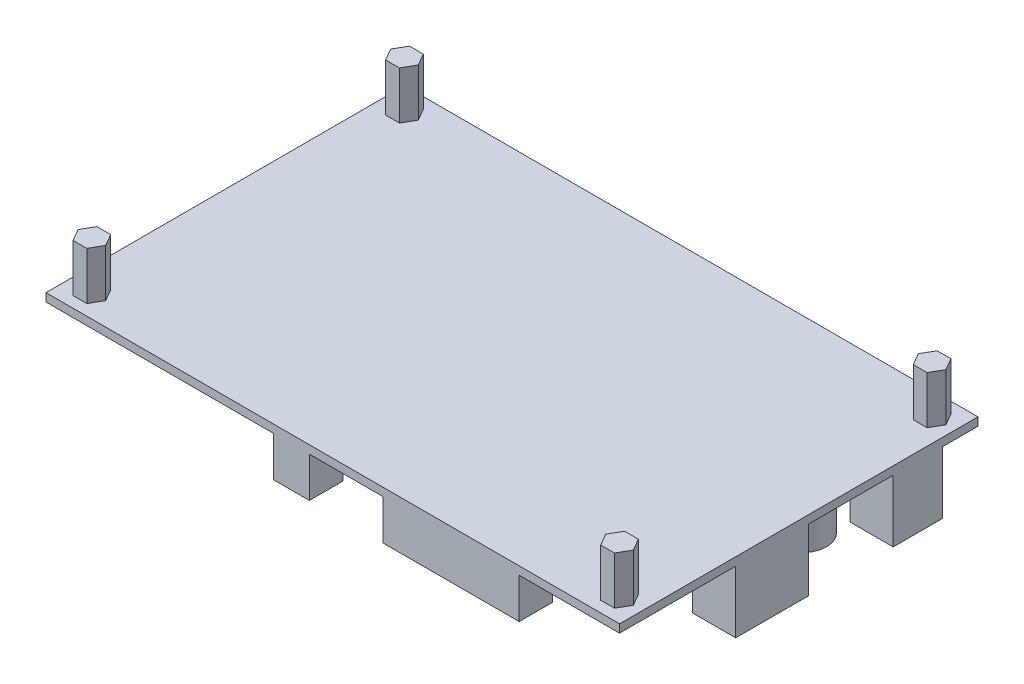
from build123d import *

# Parameters (mm, degrees)
SKETCH_1_W                        = 120
SKETCH_1_H                        = 75
EXTRUDE_1_DEPTH                   = 1.7
EXTRUDE_2_DEPTH                   = 10
SKETCH_3_W                        = 3.75
SKETCH_3_H                        = 7
EXTRUDE_3_DEPTH                   = 8.4
SKETCH_4_W                        = 28.5
SKETCH_4_H                        = 7
EXTRUDE_4_DEPTH                   = 8.4
SKETCH_5_W                        = 9
SKETCH_5_H                        = 15.2
EXTRUDE_5_DEPTH                   = 13
SKETCH_6_W                        = 9
SKETCH_6_H                        = 10.3
EXTRUDE_6_DEPTH                   = 13
SKETCH_7_R                        = 5.1
EXTRUDE_7_DEPTH                   = 16.3
SKETCH_8_W                        = 3
SKETCH_8_H                        = 2
EXTRUDE_8_DEPTH                   = 3
SKETCH_9_W                        = 1
SKETCH_9_H                        = 1
EXTRUDE_9_DEPTH                   = 8
PATTERN_LINEAR_2_COUNT            = 13
PATTERN_LINEAR_2_PITCH            = 4.183333333
PATTERN_LINEAR_3_COUNT            = 2
PATTERN_LINEAR_3_PITCH            = 2.5
PATTERN_LINEAR_3_COPY_1_SKETCH_W  = 3
PATTERN_LINEAR_3_COPY_1_SKETCH_H  = 2
PATTERN_LINEAR_3_COPY_1_DEPTH     = 3
PATTERN_LINEAR_3_COPY_2_SKETCH_W  = 3
PATTERN_LINEAR_3_COPY_2_SKETCH_H  = 2
PATTERN_LINEAR_3_COPY_2_DEPTH     = 3
PATTERN_LINEAR_3_COPY_3_SKETCH_W  = 3
PATTERN_LINEAR_3_COPY_3_SKETCH_H  = 2
PATTERN_LINEAR_3_COPY_3_DEPTH     = 3
PATTERN_LINEAR_3_COPY_4_SKETCH_W  = 3
PATTERN_LINEAR_3_COPY_4_SKETCH_H  = 2
PATTERN_LINEAR_3_COPY_4_DEPTH     = 3
PATTERN_LINEAR_3_COPY_5_SKETCH_W  = 3
PATTERN_LINEAR_3_COPY_5_SKETCH_H  = 2
PATTERN_LINEAR_3_COPY_5_DEPTH     = 3
PATTERN_LINEAR_3_COPY_6_SKETCH_W  = 3
PATTERN_LINEAR_3_COPY_6_SKETCH_H  = 2
PATTERN_LINEAR_3_COPY_6_DEPTH     = 3
PATTERN_LINEAR_3_COPY_7_SKETCH_W  = 3
PATTERN_LINEAR_3_COPY_7_SKETCH_H  = 2
PATTERN_LINEAR_3_COPY_7_DEPTH     = 3
PATTERN_LINEAR_3_COPY_8_SKETCH_W  = 3
PATTERN_LINEAR_3_COPY_8_SKETCH_H  = 2
PATTERN_LINEAR_3_COPY_8_DEPTH     = 3
PATTERN_LINEAR_3_COPY_9_SKETCH_W  = 3
PATTERN_LINEAR_3_COPY_9_SKETCH_H  = 2
PATTERN_LINEAR_3_COPY_9_DEPTH     = 3
PATTERN_LINEAR_3_COPY_10_SKETCH_W = 3
PATTERN_LINEAR_3_COPY_10_SKETCH_H = 2
PATTERN_LINEAR_3_COPY_10_DEPTH    = 3
PATTERN_LINEAR_3_COPY_11_SKETCH_W = 3
PATTERN_LINEAR_3_COPY_11_SKETCH_H = 2
PATTERN_LINEAR_3_COPY_11_DEPTH    = 3
PATTERN_LINEAR_3_COPY_12_SKETCH_W = 3
PATTERN_LINEAR_3_COPY_12_SKETCH_H = 2
PATTERN_LINEAR_3_COPY_12_DEPTH    = 3
PATTERN_LINEAR_3_COPY_13_SKETCH_W = 1
PATTERN_LINEAR_3_COPY_13_SKETCH_H = 1
PATTERN_LINEAR_3_COPY_13_DEPTH    = 8
PATTERN_LINEAR_3_COPY_14_SKETCH_W = 1
PATTERN_LINEAR_3_COPY_14_SKETCH_H = 1
PATTERN_LINEAR_3_COPY_14_DEPTH    = 8
PATTERN_LINEAR_3_COPY_15_SKETCH_W = 1
PATTERN_LINEAR_3_COPY_15_SKETCH_H = 1
PATTERN_LINEAR_3_COPY_15_DEPTH    = 8
PATTERN_LINEAR_3_COPY_16_SKETCH_W = 1
PATTERN_LINEAR_3_COPY_16_SKETCH_H = 1
PATTERN_LINEAR_3_COPY_16_DEPTH    = 8
PATTERN_LINEAR_3_COPY_17_SKETCH_W = 1
PATTERN_LINEAR_3_COPY_17_SKETCH_H = 1
PATTERN_LINEAR_3_COPY_17_DEPTH    = 8
PATTERN_LINEAR_3_COPY_18_SKETCH_W = 1
PATTERN_LINEAR_3_COPY_18_SKETCH_H = 1
PATTERN_LINEAR_3_COPY_18_DEPTH    = 8
PATTERN_LINEAR_3_COPY_19_SKETCH_W = 1
PATTERN_LINEAR_3_COPY_19_SKETCH_H = 1
PATTERN_LINEAR_3_COPY_19_DEPTH    = 8
PATTERN_LINEAR_3_COPY_20_SKETCH_W = 1
PATTERN_LINEAR_3_COPY_20_SKETCH_H = 1
PATTERN_LINEAR_3_COPY_20_DEPTH    = 8
PATTERN_LINEAR_3_COPY_21_SKETCH_W = 1
PATTERN_LINEAR_3_COPY_21_SKETCH_H = 1
PATTERN_LINEAR_3_COPY_21_DEPTH    = 8
PATTERN_LINEAR_3_COPY_22_SKETCH_W = 1
PATTERN_LINEAR_3_COPY_22_SKETCH_H = 1
PATTERN_LINEAR_3_COPY_22_DEPTH    = 8
PATTERN_LINEAR_3_COPY_23_SKETCH_W = 1
PATTERN_LINEAR_3_COPY_23_SKETCH_H = 1
PATTERN_LINEAR_3_COPY_23_DEPTH    = 8
PATTERN_LINEAR_3_COPY_24_SKETCH_W = 1
PATTERN_LINEAR_3_COPY_24_SKETCH_H = 1
PATTERN_LINEAR_3_COPY_24_DEPTH    = 8


with BuildPart() as part:
    # Эскиз1 → Бобышка-Вытянуть1 (new body)
    with BuildSketch(Plane(origin=(0, 0, 0), x_dir=(1, 0, 0), z_dir=(0, 1, 0))):
        Rectangle(SKETCH_1_W, SKETCH_1_H)
    extrude(amount=EXTRUDE_1_DEPTH)

    # Эскиз2 → Бобышка-Вытянуть2 (add)
    with BuildSketch(Plane(origin=(0, 1.7, 0), x_dir=(1, 0, 0), z_dir=(0, 1, 0))):
        Polygon((-53.756624327, -30.2), (-56.643375673, -30.2), (-58.086751346, -32.7), (-56.643375673, -35.2), (-53.756624327, -35.2), (-52.313248654, -32.7), align=None)
        Polygon((56.643375673, -35.2), (53.756624327, -35.2), (52.313248654, -32.7), (53.756624327, -30.2), (56.643375673, -30.2), (58.086751346, -32.7), align=None)
        Polygon((52.313248654, 32.7), (53.756624327, 30.2), (56.643375673, 30.2), (58.086751346, 32.7), (56.643375673, 35.2), (53.756624327, 35.2), align=None)
        Polygon((-58.086751346, 32.7), (-56.643375673, 35.2), (-53.756624327, 35.2), (-52.313248654, 32.7), (-53.756624327, 30.2), (-56.643375673, 30.2), align=None)
    extrude(amount=EXTRUDE_2_DEPTH)

    # Эскиз3 → Бобышка-Вытянуть3 (add)
    with BuildSketch(Plane.XZ):
        with Locations((-6.775, 34)):
            Rectangle(SKETCH_3_W, SKETCH_3_H)
    extrude_3 = extrude(amount=EXTRUDE_3_DEPTH)

    # Зеркальное отражение2: Бобышка-Вытянуть3 across plane
    add(extrude_3.mirror(Plane(origin=(-8.65, -8.4, 37.5), x_dir=(0, 0, 1), z_dir=(1, 0, 0))))

    # Эскиз4 → Бобышка-Вытянуть4 (add)
    with BuildSketch(Plane.XZ):
        with Locations((24.75, 34)):
            Rectangle(SKETCH_4_W, SKETCH_4_H)
    extrude(amount=EXTRUDE_4_DEPTH)

    # Эскиз5 → Бобышка-Вытянуть5 (add)
    with BuildSketch(Plane.XZ):
        with Locations((55.5, 5.6)):
            Rectangle(SKETCH_5_W, SKETCH_5_H)
    extrude(amount=EXTRUDE_5_DEPTH)

    # Эскиз6 → Бобышка-Вытянуть6 (add)
    with BuildSketch(Plane.XZ):
        with Locations((55.5, -24.9)):
            Rectangle(SKETCH_6_W, SKETCH_6_H)
    extrude(amount=EXTRUDE_6_DEPTH)

    # Эскиз7 → Бобышка-Вытянуть7 (add)
    with BuildSketch(Plane.XZ):
        with Locations(Location((44.6, -16.1, 0), (0, 0, 90))):
            Circle(SKETCH_7_R)
    extrude(amount=EXTRUDE_7_DEPTH)

    # Эскиз8 → Бобышка-Вытянуть8 (add)
    with BuildSketch(Plane.XZ):
        with Locations((10.2, -7.9)):
            Rectangle(SKETCH_8_W, SKETCH_8_H)
    extrude_8 = extrude(amount=EXTRUDE_8_DEPTH)

    # Эскиз9 → Бобышка-Вытянуть9 (add)
    with BuildSketch(Plane.XZ.offset(3)):
        with Locations((10.335563445, -7.88710339)):
            Rectangle(SKETCH_9_W, SKETCH_9_H)
    extrude_9 = extrude(amount=EXTRUDE_9_DEPTH)

    # Линейный массив2: Бобышка-Вытянуть8, Бобышка-Вытянуть9 ×13
    with Locations(*[(-i * PATTERN_LINEAR_2_PITCH, 0, 0) for i in range(1, PATTERN_LINEAR_2_COUNT)]):
        add(extrude_8)
        add(extrude_9)

    # Линейный массив3: Бобышка-Вытянуть8, Бобышка-Вытянуть9 ×2
    with Locations(*[(0, 0, -i * PATTERN_LINEAR_3_PITCH) for i in range(1, PATTERN_LINEAR_3_COUNT)]):
        add(extrude_8)
        add(extrude_9)

    # Линейный массив3 copy 1 sketch → Линейный массив3 copy 1 (add)
    with BuildSketch(Plane(origin=(-4.183333333, 0, -2.5), x_dir=(1, 0, 0), z_dir=(0, -1, 0))):
        with Locations((10.2, -7.9)):
            Rectangle(PATTERN_LINEAR_3_COPY_1_SKETCH_W, PATTERN_LINEAR_3_COPY_1_SKETCH_H)
    extrude(amount=PATTERN_LINEAR_3_COPY_1_DEPTH)

    # Линейный массив3 copy 2 sketch → Линейный массив3 copy 2 (add)
    with BuildSketch(Plane(origin=(-8.366666667, 0, -2.5), x_dir=(1, 0, 0), z_dir=(0, -1, 0))):
        with Locations((10.2, -7.9)):
            Rectangle(PATTERN_LINEAR_3_COPY_2_SKETCH_W, PATTERN_LINEAR_3_COPY_2_SKETCH_H)
    extrude(amount=PATTERN_LINEAR_3_COPY_2_DEPTH)

    # Линейный массив3 copy 3 sketch → Линейный массив3 copy 3 (add)
    with BuildSketch(Plane(origin=(-12.55, 0, -2.5), x_dir=(1, 0, 0), z_dir=(0, -1, 0))):
        with Locations((10.2, -7.9)):
            Rectangle(PATTERN_LINEAR_3_COPY_3_SKETCH_W, PATTERN_LINEAR_3_COPY_3_SKETCH_H)
    extrude(amount=PATTERN_LINEAR_3_COPY_3_DEPTH)

    # Линейный массив3 copy 4 sketch → Линейный массив3 copy 4 (add)
    with BuildSketch(Plane(origin=(-16.733333333, 0, -2.5), x_dir=(1, 0, 0), z_dir=(0, -1, 0))):
        with Locations((10.2, -7.9)):
            Rectangle(PATTERN_LINEAR_3_COPY_4_SKETCH_W, PATTERN_LINEAR_3_COPY_4_SKETCH_H)
    extrude(amount=PATTERN_LINEAR_3_COPY_4_DEPTH)

    # Линейный массив3 copy 5 sketch → Линейный массив3 copy 5 (add)
    with BuildSketch(Plane(origin=(-20.916666667, 0, -2.5), x_dir=(1, 0, 0), z_dir=(0, -1, 0))):
        with Locations((10.2, -7.9)):
            Rectangle(PATTERN_LINEAR_3_COPY_5_SKETCH_W, PATTERN_LINEAR_3_COPY_5_SKETCH_H)
    extrude(amount=PATTERN_LINEAR_3_COPY_5_DEPTH)

    # Линейный массив3 copy 6 sketch → Линейный массив3 copy 6 (add)
    with BuildSketch(Plane(origin=(-25.1, 0, -2.5), x_dir=(1, 0, 0), z_dir=(0, -1, 0))):
        with Locations((10.2, -7.9)):
            Rectangle(PATTERN_LINEAR_3_COPY_6_SKETCH_W, PATTERN_LINEAR_3_COPY_6_SKETCH_H)
    extrude(amount=PATTERN_LINEAR_3_COPY_6_DEPTH)

    # Линейный массив3 copy 7 sketch → Линейный массив3 copy 7 (add)
    with BuildSketch(Plane(origin=(-29.283333333, 0, -2.5), x_dir=(1, 0, 0), z_dir=(0, -1, 0))):
        with Locations((10.2, -7.9)):
            Rectangle(PATTERN_LINEAR_3_COPY_7_SKETCH_W, PATTERN_LINEAR_3_COPY_7_SKETCH_H)
    extrude(amount=PATTERN_LINEAR_3_COPY_7_DEPTH)

    # Линейный массив3 copy 8 sketch → Линейный массив3 copy 8 (add)
    with BuildSketch(Plane(origin=(-33.466666667, 0, -2.5), x_dir=(1, 0, 0), z_dir=(0, -1, 0))):
        with Locations((10.2, -7.9)):
            Rectangle(PATTERN_LINEAR_3_COPY_8_SKETCH_W, PATTERN_LINEAR_3_COPY_8_SKETCH_H)
    extrude(amount=PATTERN_LINEAR_3_COPY_8_DEPTH)

    # Линейный массив3 copy 9 sketch → Линейный массив3 copy 9 (add)
    with BuildSketch(Plane(origin=(-37.65, 0, -2.5), x_dir=(1, 0, 0), z_dir=(0, -1, 0))):
        with Locations((10.2, -7.9)):
            Rectangle(PATTERN_LINEAR_3_COPY_9_SKETCH_W, PATTERN_LINEAR_3_COPY_9_SKETCH_H)
    extrude(amount=PATTERN_LINEAR_3_COPY_9_DEPTH)

    # Линейный массив3 copy 10 sketch → Линейный массив3 copy 10 (add)
    with BuildSketch(Plane(origin=(-41.833333333, 0, -2.5), x_dir=(1, 0, 0), z_dir=(0, -1, 0))):
        with Locations((10.2, -7.9)):
            Rectangle(PATTERN_LINEAR_3_COPY_10_SKETCH_W, PATTERN_LINEAR_3_COPY_10_SKETCH_H)
    extrude(amount=PATTERN_LINEAR_3_COPY_10_DEPTH)

    # Линейный массив3 copy 11 sketch → Линейный массив3 copy 11 (add)
    with BuildSketch(Plane(origin=(-46.016666667, 0, -2.5), x_dir=(1, 0, 0), z_dir=(0, -1, 0))):
        with Locations((10.2, -7.9)):
            Rectangle(PATTERN_LINEAR_3_COPY_11_SKETCH_W, PATTERN_LINEAR_3_COPY_11_SKETCH_H)
    extrude(amount=PATTERN_LINEAR_3_COPY_11_DEPTH)

    # Линейный массив3 copy 12 sketch → Линейный массив3 copy 12 (add)
    with BuildSketch(Plane(origin=(-50.2, 0, -2.5), x_dir=(1, 0, 0), z_dir=(0, -1, 0))):
        with Locations((10.2, -7.9)):
            Rectangle(PATTERN_LINEAR_3_COPY_12_SKETCH_W, PATTERN_LINEAR_3_COPY_12_SKETCH_H)
    extrude(amount=PATTERN_LINEAR_3_COPY_12_DEPTH)

    # Линейный массив3 copy 13 sketch → Линейный массив3 copy 13 (add)
    with BuildSketch(Plane(origin=(-4.183333333, -3, -2.5), x_dir=(1, 0, 0), z_dir=(0, -1, 0))):
        with Locations((10.335563445, -7.88710339)):
            Rectangle(PATTERN_LINEAR_3_COPY_13_SKETCH_W, PATTERN_LINEAR_3_COPY_13_SKETCH_H)
    extrude(amount=PATTERN_LINEAR_3_COPY_13_DEPTH)

    # Линейный массив3 copy 14 sketch → Линейный массив3 copy 14 (add)
    with BuildSketch(Plane(origin=(-8.366666667, -3, -2.5), x_dir=(1, 0, 0), z_dir=(0, -1, 0))):
        with Locations((10.335563445, -7.88710339)):
            Rectangle(PATTERN_LINEAR_3_COPY_14_SKETCH_W, PATTERN_LINEAR_3_COPY_14_SKETCH_H)
    extrude(amount=PATTERN_LINEAR_3_COPY_14_DEPTH)

    # Линейный массив3 copy 15 sketch → Линейный массив3 copy 15 (add)
    with BuildSketch(Plane(origin=(-12.55, -3, -2.5), x_dir=(1, 0, 0), z_dir=(0, -1, 0))):
        with Locations((10.335563445, -7.88710339)):
            Rectangle(PATTERN_LINEAR_3_COPY_15_SKETCH_W, PATTERN_LINEAR_3_COPY_15_SKETCH_H)
    extrude(amount=PATTERN_LINEAR_3_COPY_15_DEPTH)

    # Линейный массив3 copy 16 sketch → Линейный массив3 copy 16 (add)
    with BuildSketch(Plane(origin=(-16.733333333, -3, -2.5), x_dir=(1, 0, 0), z_dir=(0, -1, 0))):
        with Locations((10.335563445, -7.88710339)):
            Rectangle(PATTERN_LINEAR_3_COPY_16_SKETCH_W, PATTERN_LINEAR_3_COPY_16_SKETCH_H)
    extrude(amount=PATTERN_LINEAR_3_COPY_16_DEPTH)

    # Линейный массив3 copy 17 sketch → Линейный массив3 copy 17 (add)
    with BuildSketch(Plane(origin=(-20.916666667, -3, -2.5), x_dir=(1, 0, 0), z_dir=(0, -1, 0))):
        with Locations((10.335563445, -7.88710339)):
            Rectangle(PATTERN_LINEAR_3_COPY_17_SKETCH_W, PATTERN_LINEAR_3_COPY_17_SKETCH_H)
    extrude(amount=PATTERN_LINEAR_3_COPY_17_DEPTH)

    # Линейный массив3 copy 18 sketch → Линейный массив3 copy 18 (add)
    with BuildSketch(Plane(origin=(-25.1, -3, -2.5), x_dir=(1, 0, 0), z_dir=(0, -1, 0))):
        with Locations((10.335563445, -7.88710339)):
            Rectangle(PATTERN_LINEAR_3_COPY_18_SKETCH_W, PATTERN_LINEAR_3_COPY_18_SKETCH_H)
    extrude(amount=PATTERN_LINEAR_3_COPY_18_DEPTH)

    # Линейный массив3 copy 19 sketch → Линейный массив3 copy 19 (add)
    with BuildSketch(Plane(origin=(-29.283333333, -3, -2.5), x_dir=(1, 0, 0), z_dir=(0, -1, 0))):
        with Locations((10.335563445, -7.88710339)):
            Rectangle(PATTERN_LINEAR_3_COPY_19_SKETCH_W, PATTERN_LINEAR_3_COPY_19_SKETCH_H)
    extrude(amount=PATTERN_LINEAR_3_COPY_19_DEPTH)

    # Линейный массив3 copy 20 sketch → Линейный массив3 copy 20 (add)
    with BuildSketch(Plane(origin=(-33.466666667, -3, -2.5), x_dir=(1, 0, 0), z_dir=(0, -1, 0))):
        with Locations((10.335563445, -7.88710339)):
            Rectangle(PATTERN_LINEAR_3_COPY_20_SKETCH_W, PATTERN_LINEAR_3_COPY_20_SKETCH_H)
    extrude(amount=PATTERN_LINEAR_3_COPY_20_DEPTH)

    # Линейный массив3 copy 21 sketch → Линейный массив3 copy 21 (add)
    with BuildSketch(Plane(origin=(-37.65, -3, -2.5), x_dir=(1, 0, 0), z_dir=(0, -1, 0))):
        with Locations((10.335563445, -7.88710339)):
            Rectangle(PATTERN_LINEAR_3_COPY_21_SKETCH_W, PATTERN_LINEAR_3_COPY_21_SKETCH_H)
    extrude(amount=PATTERN_LINEAR_3_COPY_21_DEPTH)

    # Линейный массив3 copy 22 sketch → Линейный массив3 copy 22 (add)
    with BuildSketch(Plane(origin=(-41.833333333, -3, -2.5), x_dir=(1, 0, 0), z_dir=(0, -1, 0))):
        with Locations((10.335563445, -7.88710339)):
            Rectangle(PATTERN_LINEAR_3_COPY_22_SKETCH_W, PATTERN_LINEAR_3_COPY_22_SKETCH_H)
    extrude(amount=PATTERN_LINEAR_3_COPY_22_DEPTH)

    # Линейный массив3 copy 23 sketch → Линейный массив3 copy 23 (add)
    with BuildSketch(Plane(origin=(-46.016666667, -3, -2.5), x_dir=(1, 0, 0), z_dir=(0, -1, 0))):
        with Locations((10.335563445, -7.88710339)):
            Rectangle(PATTERN_LINEAR_3_COPY_23_SKETCH_W, PATTERN_LINEAR_3_COPY_23_SKETCH_H)
    extrude(amount=PATTERN_LINEAR_3_COPY_23_DEPTH)

    # Линейный массив3 copy 24 sketch → Линейный массив3 copy 24 (add)
    with BuildSketch(Plane(origin=(-50.2, -3, -2.5), x_dir=(1, 0, 0), z_dir=(0, -1, 0))):
        with Locations((10.335563445, -7.88710339)):
            Rectangle(PATTERN_LINEAR_3_COPY_24_SKETCH_W, PATTERN_LINEAR_3_COPY_24_SKETCH_H)
    extrude(amount=PATTERN_LINEAR_3_COPY_24_DEPTH)


solid = part.part
